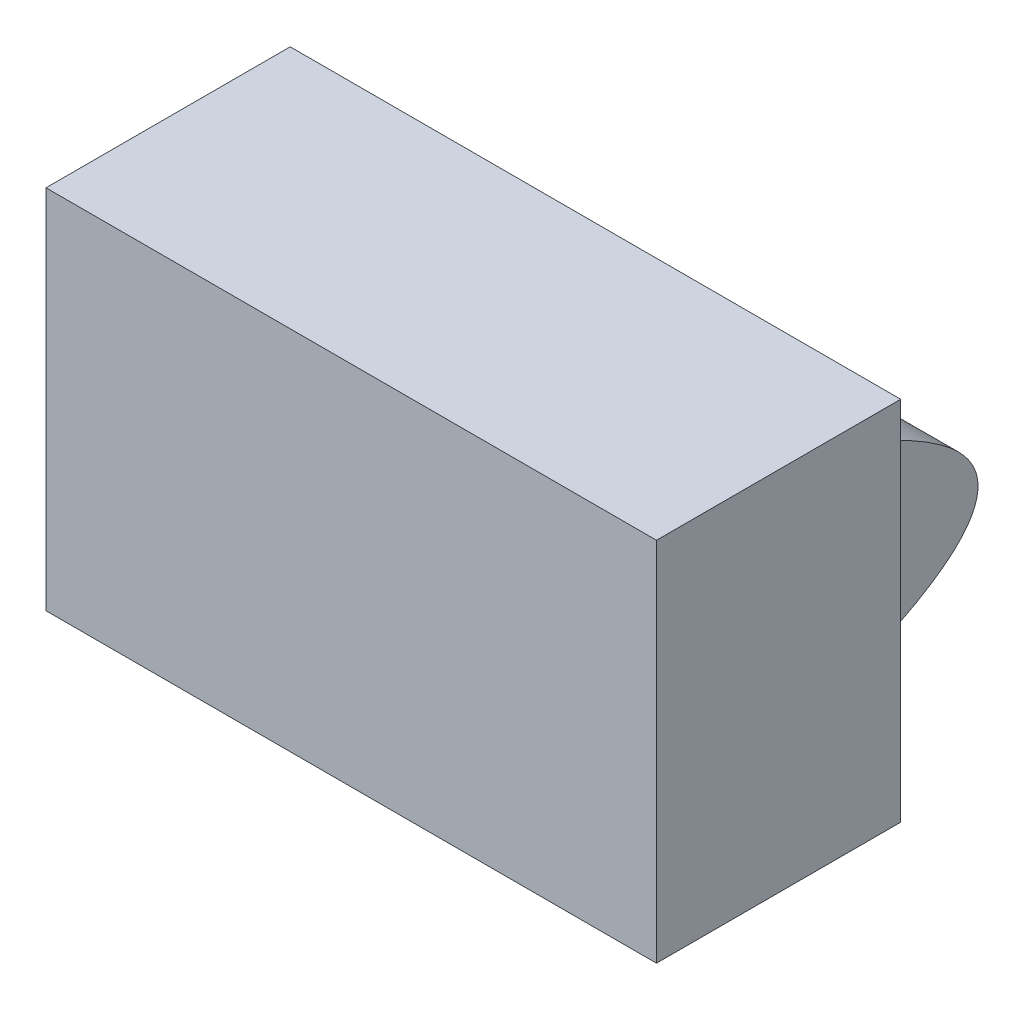
from build123d import *

# Parameters (mm, degrees)
SKETCH_1_W          = 7.5
SKETCH_1_H          = 3
EXTRUDE_1_DEPTH     = 4.5
SKETCH_2_W          = 1.2
SKETCH_2_H          = 2.5
EXTRUDE_2_DEPTH     = 1.6
CUT_EXTRUDE_1_DEPTH = 10.39853712


with BuildPart() as part:
    # 草图1 → 凸台-拉伸1 (new body)
    with BuildSketch(Plane(origin=(0, 0, 0), x_dir=(1, 0, 0), z_dir=(0, 1, 0))):
        with Locations((-3.75, 1.5)):
            Rectangle(SKETCH_1_W, SKETCH_1_H)
    extrude(amount=EXTRUDE_1_DEPTH)

    # 草图2 → 凸台-拉伸2 (add)
    with BuildSketch(Plane(origin=(0, 0, -3), x_dir=(-1, 0, 0), z_dir=(0, 0, -1))):
        with Locations((1.25, 2.45)):
            Rectangle(SKETCH_2_W, SKETCH_2_H)
        with Locations((3.75, 2.45)):
            Rectangle(SKETCH_2_W, SKETCH_2_H)
        with Locations((6.25, 2.45)):
            Rectangle(SKETCH_2_W, SKETCH_2_H)
    extrude(amount=EXTRUDE_2_DEPTH)

    # 草图3 → 切除-拉伸1 (cut, through all)
    with BuildSketch(Plane(origin=(-0.65, 0, 0), x_dir=(0, 0, -1), z_dir=(1, 0, 0))):
        with BuildLine():
            add(Edge.make_bspline(
                [(4.6, 2.45), (4.6, 3.075), (3, 3.7)],
                knots=[0.5, 0.5, 0.5, 1, 1, 1], degree=2))
            Line((4.6, 2.45), (4.6, 3.7))
            Line((4.6, 3.7), (3, 3.7))
        make_face()
        with BuildLine():
            add(Edge.make_bspline(
                [(3, 1.2), (4.6, 1.825), (4.6, 2.45)],
                knots=[0, 0, 0, 0.5, 0.5, 0.5], degree=2))
            Line((3, 1.2), (4.6, 1.2))
            Line((4.6, 1.2), (4.6, 2.45))
        make_face()
    extrude(amount=-CUT_EXTRUDE_1_DEPTH, mode=Mode.SUBTRACT)


solid = part.part
